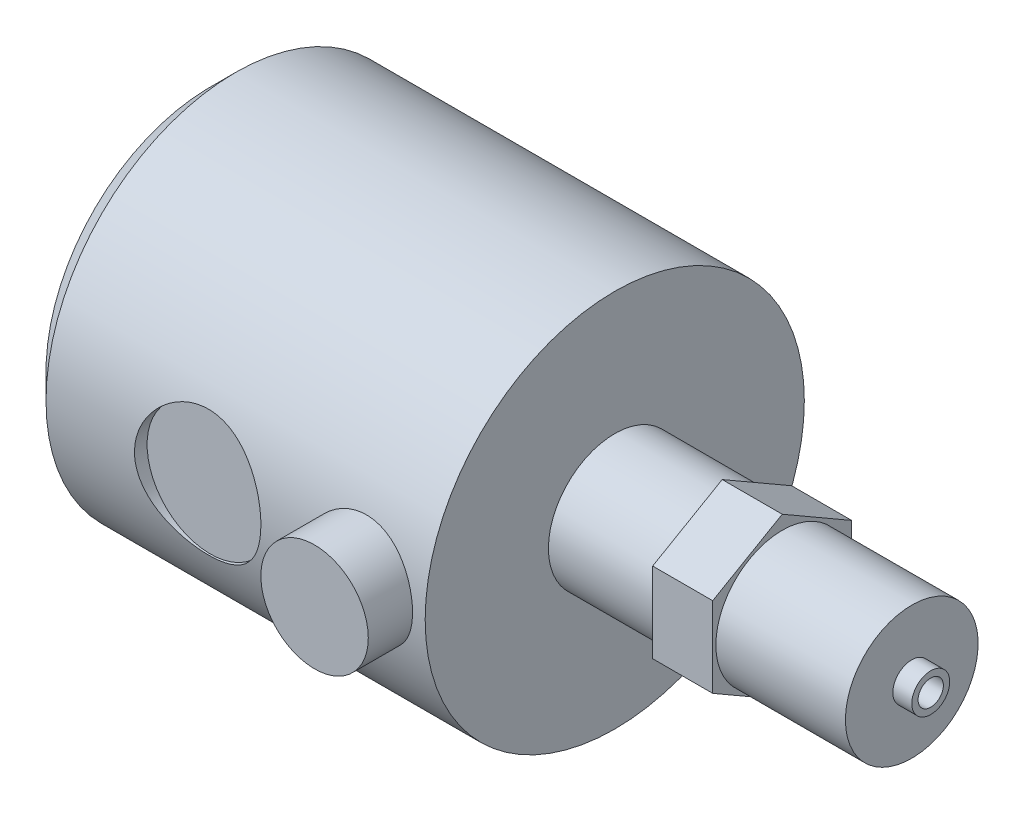
from build123d import *

# Parameters (mm, degrees)
ZKOSEN_1_SIZE            = 4
SKICA2_R                 = 10
ODEBRAT_VYSUNUT_M1_DEPTH = 2
P_IDAT_VYSUNUT_M1_DEPTH  = 9.5
SKICA4_R                 = 3
SKICA4_R_2               = 2
P_IDAT_VYSUNUT_M2_DEPTH  = 3
SKICA5_R                 = 8.5
P_IDAT_VYSUNUT_M3_DEPTH  = 9


with BuildPart() as part:
    # Skica1 → Rotovat1 (revolve)
    with BuildSketch(Plane.XY, mode=Mode.PRIVATE) as rotovat1_sk:
        Polygon((0, 0), (0, 30), (64, 30), (64, 10.5), (111, 10.5), (111, 0), align=None)
    revolve(rotovat1_sk.sketch.rotate(Axis((0, 0, 0), (1, 0, 0)), 90), axis=Axis((0, 0, 0), (1, 0, 0)))

    # Zkosení1
    zkosen_1_edges = [part.edges().sort_by_distance(p)[0] for p in [
        (0, 0, -30),
    ]]
    chamfer(zkosen_1_edges, length=ZKOSEN_1_SIZE)

    # Skica2 → Odebrat vysunutím1 (cut)
    with BuildSketch(Plane.XY.offset(30)):
        with Locations((28, 0)):
            Circle(SKICA2_R)
    extrude(amount=-ODEBRAT_VYSUNUT_M1_DEPTH, mode=Mode.SUBTRACT)

    # Skica3 → Přidat vysunutím1 (add)
    with BuildSketch(Plane(origin=(81, 0, 0), x_dir=(0, 0, -1), z_dir=(1, 0, 0))):
        Polygon((0, 12.701705922), (-11, 6.350852961), (-11, -6.350852961), (0, -12.701705922), (11, -6.350852961), (11, 6.350852961), align=None)
    extrude(amount=P_IDAT_VYSUNUT_M1_DEPTH)

    # Skica4 → Přidat vysunutím2 (add)
    with BuildSketch(Plane(origin=(111, 0, 0), x_dir=(0, 0, -1), z_dir=(1, 0, 0))):
        with Locations(Location((0, 0, 0), (0, 0, 180))):
            Circle(SKICA4_R)
        Circle(SKICA4_R_2, mode=Mode.SUBTRACT)
    extrude(amount=P_IDAT_VYSUNUT_M2_DEPTH)

    # Skica5 → Přidat vysunutím3 (add)
    with BuildSketch(Plane.XY.offset(28)):
        with Locations((53.5, 0)):
            Circle(SKICA5_R)
    extrude(amount=P_IDAT_VYSUNUT_M3_DEPTH)


solid = part.part
